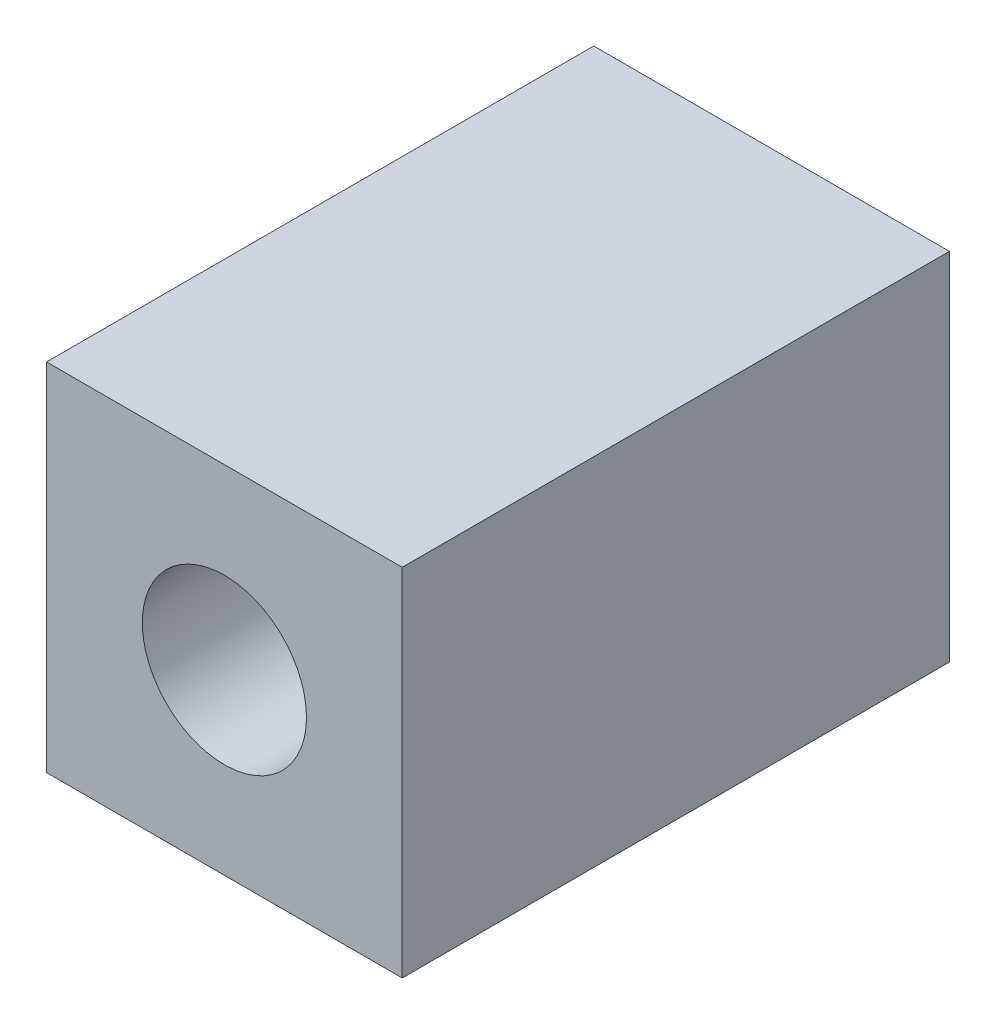
from build123d import *

# Parameters (mm, degrees)
SKETCH_2_W      = 130
SKETCH_2_H      = 130
SKETCH_2_R      = 30
EXTRUDE_2_DEPTH = 200


with BuildPart() as part:
    # 스케치2 → 보스-돌출2 (new body)
    with BuildSketch(Plane.XY):
        Rectangle(SKETCH_2_W, SKETCH_2_H)
        Circle(SKETCH_2_R, mode=Mode.SUBTRACT)
    extrude(amount=EXTRUDE_2_DEPTH)


solid = part.part
